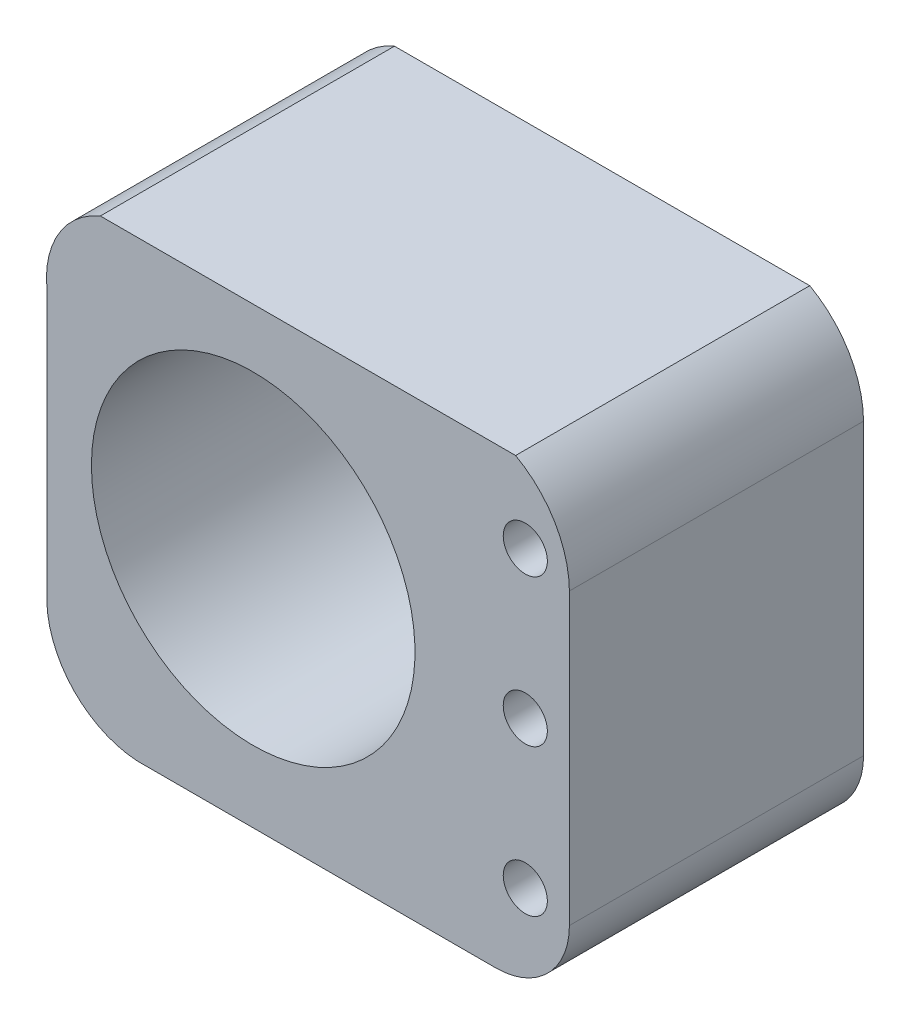
from build123d import *

# Parameters (mm, degrees)
CROQUIS1_R              = 11
CROQUIS1_R_2            = 1.5
SALIENTE_EXTRUIR1_DEPTH = 20


with BuildPart() as part:
    # Croquis1 → Saliente-Extruir1 (new body)
    with BuildSketch(Plane.XY):
        with BuildLine():
            Line((19.934911271, -13.245043478), (44.365127053, -13.245043478))
            ThreePointArc((44.365127053, -13.245043478), (47.900660959, -11.780577384), (49.365127053, -8.245043478))
            Line((49.365127053, -8.245043478), (49.365127053, 11.454956522))
            ThreePointArc((49.365127053, 11.454956522), (48.364801216, 15.022297578), (45.708403889, 17.604956522))
            Line((45.708403889, 17.604956522), (17.470852565, 17.589387044))
            ThreePointArc((17.470852565, 17.589387044), (14.633403866, 15.127424661), (13.842612072, 11.454956522))
            Line((13.842612072, 11.454956522), (13.842612072, -6.245043478))
            ThreePointArc((13.842612072, -6.245043478), (15.439014203, -11.006799955), (19.934911271, -13.245043478))
        make_face()
        with Locations(Location((27.865127053, 2.604956522, 0), (0, 0, 180))):
            Circle(CROQUIS1_R, mode=Mode.SUBTRACT)
        with Locations(Location((46.365127053, 2.454956522, 0), (0, 0, 180))):
            Circle(CROQUIS1_R_2, mode=Mode.SUBTRACT)
        with Locations(Location((46.365127053, 12.454956522, 0), (0, 0, 180))):
            Circle(CROQUIS1_R_2, mode=Mode.SUBTRACT)
        with Locations(Location((46.365127053, -7.545043478, 0), (0, 0, 180))):
            Circle(CROQUIS1_R_2, mode=Mode.SUBTRACT)
    extrude(amount=SALIENTE_EXTRUIR1_DEPTH)


solid = part.part
